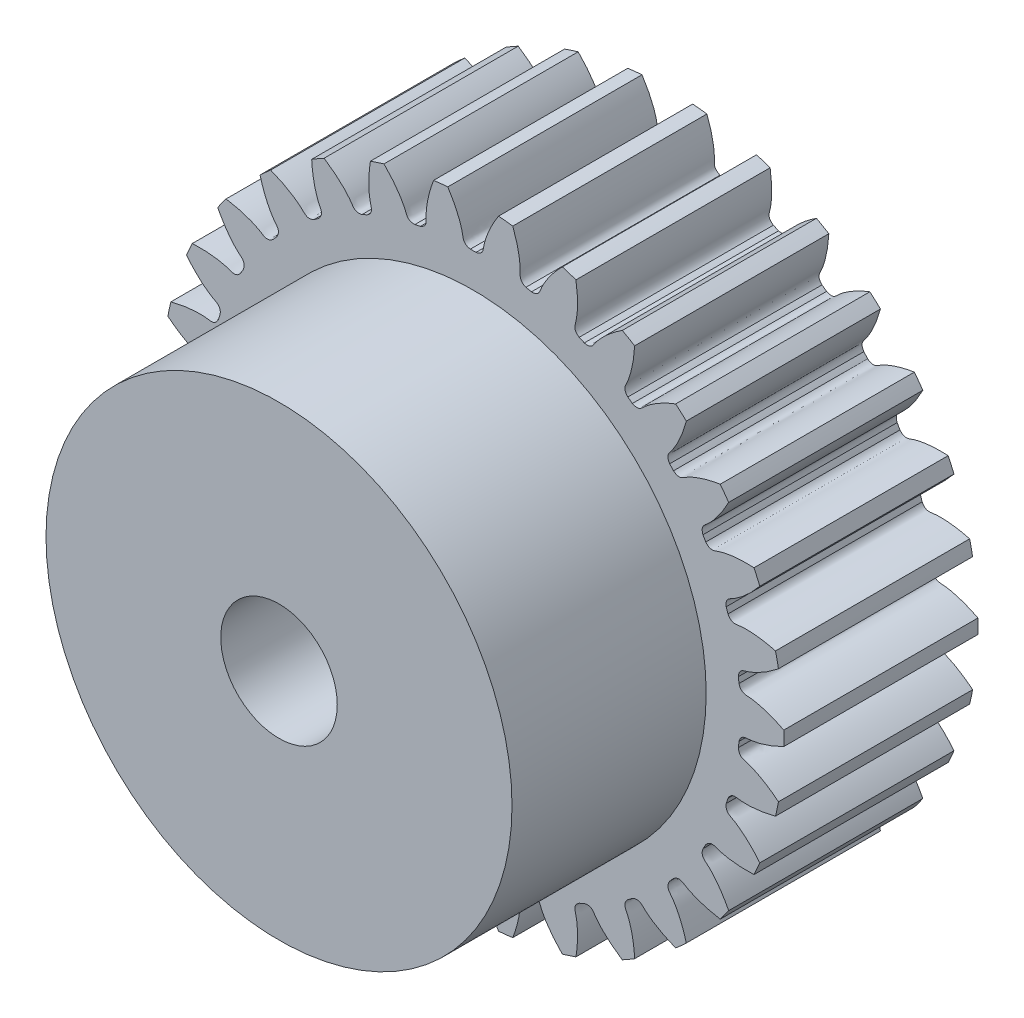
from build123d import *

# Parameters (mm, degrees)
SKETCH_1_R               = 8
EXTRUDE_1_DEPTH          = 5
CUT_EXTRUDE_1_DEPTH      = 13.369316877
PATTERN_CIRCULAR_1_COUNT = 30
SKETCH_5_R               = 6
EXTRUDE_2_DEPTH          = 5
SKETCH_6_R               = 1.5
CUT_EXTRUDE_3_DEPTH      = 18


with BuildPart() as part:
    # 草图1 → 凸台-拉伸1 (new body)
    with BuildSketch(Plane.XY):
        Circle(SKETCH_1_R)
    extrude(amount=EXTRUDE_1_DEPTH)

    # 草图2 → 切除-拉伸1 (cut, through all)
    with BuildSketch(Plane.XY):
        with BuildLine():
            ThreePointArc((0.072779314, 6.874614765), (0, 6.875), (-0.072779314, 6.874614765))
            add(Edge.make_bspline(
                [(-0.072779314, 6.874614765), (-0.254115345, 6.906487585), (-0.255152373, 7.023566318), (-0.27949241, 7.144289508), (-0.284975371, 7.169064619), (-0.291623543, 7.196462455), (-0.299533859, 7.226448996), (-0.308815312, 7.258982454), (-0.319571679, 7.294019257), (-0.331906756, 7.331512239), (-0.345922647, 7.37141123), (-0.361720171, 7.413662928), (-0.379398634, 7.458210975), (-0.399055788, 7.504995991), (-0.420787741, 7.553955613), (-0.444688876, 7.605024538), (-0.470851774, 7.658134564), (-0.499367135, 7.713214643), (-0.530323704, 7.770190925), (-0.563808189, 7.828986808), (-0.599905197, 7.889522992), (-0.638697148, 7.951717532), (-0.680264215, 8.015485894), (-0.724684248, 8.080741014), (-0.772032703, 8.147393354), (-0.822382582, 8.215350967), (-0.875804359, 8.284519558), (-0.932365919, 8.354802549), (-0.992132498, 8.426101145), (-1.055166616, 8.498314402), (-1.121528021, 8.571339295), (-1.191273632, 8.645070792), (-1.264457479, 8.719401924), (-1.341130655, 8.794223857), (-1.421341241, 8.869425973), (-1.534461933, 8.971310414), (-1.622672309, 9.046035766), (-1.683155916, 9.095279061)],
                knots=[0, 0, 0, 0, 0.115323882, 0.12341257, 0.132512303, 0.142623081, 0.153744905, 0.165877774, 0.179021689, 0.193176649, 0.208342655, 0.224519706, 0.241707802, 0.259906945, 0.279117132, 0.299338365, 0.320570644, 0.342813968, 0.366068337, 0.390333752, 0.415610213, 0.441897719, 0.46919627, 0.497505867, 0.52682651, 0.557158198, 0.588500931, 0.62085471, 0.654219534, 0.688595404, 0.723982319, 0.76038028, 0.797789286, 0.836209338, 0.875640435, 0.916082578, 1, 1, 1, 1], degree=3))
            ThreePointArc((-1.683155916, 9.095279061), (0, 9.249708917), (1.683155916, 9.095279061))
            add(Edge.make_bspline(
                [(0.072779314, 6.874614765), (0.254115345, 6.906487585), (0.255152373, 7.023566318), (0.27949241, 7.144289508), (0.284975371, 7.169064619), (0.291623543, 7.196462455), (0.299533859, 7.226448996), (0.308815312, 7.258982454), (0.319571679, 7.294019257), (0.331906756, 7.331512239), (0.345922647, 7.37141123), (0.361720171, 7.413662928), (0.379398634, 7.458210975), (0.399055788, 7.504995991), (0.420787741, 7.553955613), (0.444688876, 7.605024538), (0.470851774, 7.658134564), (0.499367135, 7.713214643), (0.530323704, 7.770190925), (0.563808189, 7.828986808), (0.599905197, 7.889522992), (0.638697148, 7.951717532), (0.680264215, 8.015485894), (0.724684248, 8.080741014), (0.772032703, 8.147393354), (0.822382582, 8.215350967), (0.875804359, 8.284519558), (0.932365919, 8.354802549), (0.992132498, 8.426101145), (1.055166616, 8.498314402), (1.121528021, 8.571339295), (1.191273632, 8.645070792), (1.264457479, 8.719401924), (1.341130655, 8.794223857), (1.421341241, 8.869425973), (1.534461933, 8.971310414), (1.622672309, 9.046035766), (1.683155916, 9.095279061)],
                knots=[0, 0, 0, 0, 0.115323882, 0.12341257, 0.132512303, 0.142623081, 0.153744905, 0.165877774, 0.179021689, 0.193176649, 0.208342655, 0.224519706, 0.241707802, 0.259906945, 0.279117132, 0.299338365, 0.320570644, 0.342813968, 0.366068337, 0.390333752, 0.415610213, 0.441897719, 0.46919627, 0.497505867, 0.52682651, 0.557158198, 0.588500931, 0.62085471, 0.654219534, 0.688595404, 0.723982319, 0.76038028, 0.797789286, 0.836209338, 0.875640435, 0.916082578, 1, 1, 1, 1], degree=3))
        make_face()
    cut_extrude_1 = extrude(amount=CUT_EXTRUDE_1_DEPTH, mode=Mode.SUBTRACT)

    # 阵列(圆周)1: 切除-拉伸1 ×30 about axis
    pattern_circular_1_axis = Axis((0, 0, 5), (0, 0, -1))
    for i in range(1, PATTERN_CIRCULAR_1_COUNT):
        add(cut_extrude_1.rotate(pattern_circular_1_axis, i * 360 / PATTERN_CIRCULAR_1_COUNT), mode=Mode.SUBTRACT)

    # 草图5 → 凸台-拉伸2 (add)
    with BuildSketch(Plane.XY.offset(5)):
        Circle(SKETCH_5_R)
    extrude(amount=EXTRUDE_2_DEPTH)

    # 草图6 → 切除-拉伸3 (cut)
    with BuildSketch(Plane.XY.offset(10)):
        Circle(SKETCH_6_R)
    extrude(amount=-CUT_EXTRUDE_3_DEPTH, mode=Mode.SUBTRACT)


solid = part.part
